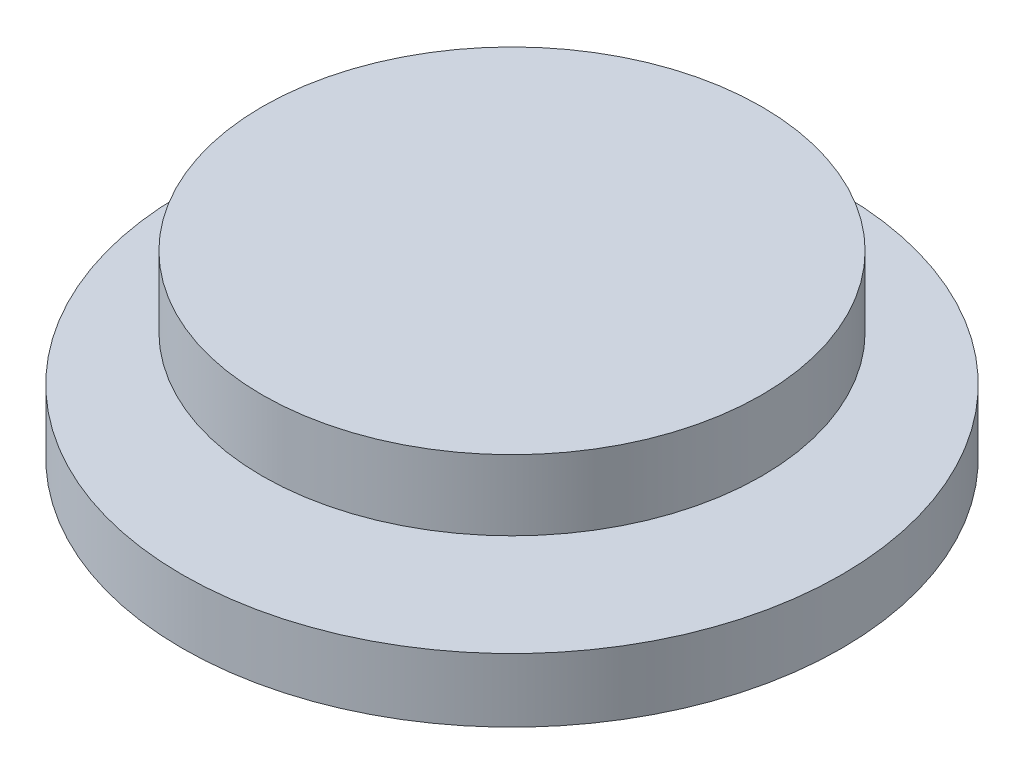
from build123d import *


with BuildPart() as part:
    # Sketch1 → Revolve1 (revolve)
    with BuildSketch(Plane.XY, mode=Mode.PRIVATE) as revolve1_sk:
        Polygon((-28.065915654, -31.971254355), (-28.065915654, 38.490882695), (29.85847459, 38.490882695), (29.85847459, 22.191811847), (0.896279468, 22.191811847), (0.896279468, 11.66010453), (48.414339863, 11.66010453), (48.414339863, -3.134436702), (0.896279468, -15.922938444), (0.896279468, -31.971254355), align=None)
    revolve(revolve1_sk.sketch.rotate(Axis((-28.065915654, -31.971254355, 0), (0, 1, 0)), 90), axis=Axis((-28.065915654, -31.971254355, 0), (0, 1, 0)))


solid = part.part
